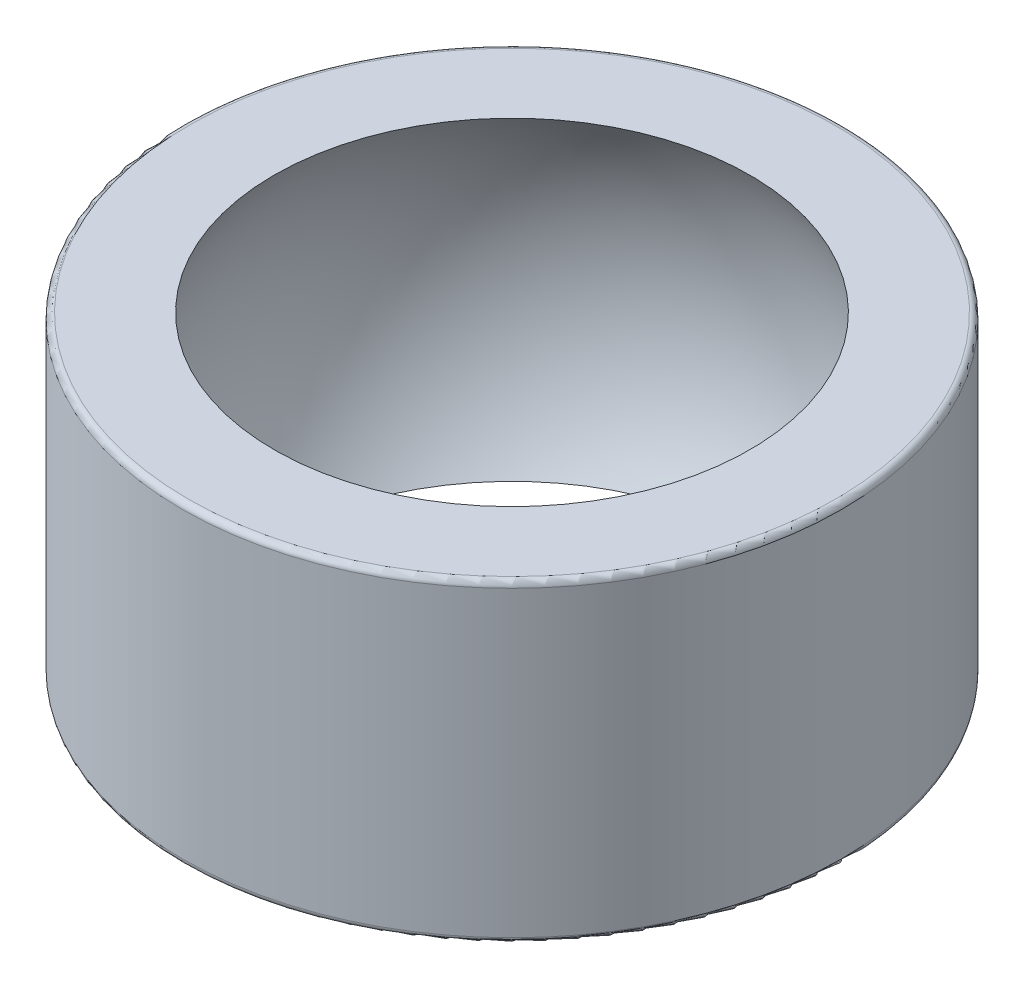
from build123d import *

# Parameters (mm, degrees)
SZKIC1_R                    = 11
DODANIE_WYCI_GNI_CIE1_DEPTH = 5.25
ZAOKR_GLENIE1_R             = 0.2


with BuildPart() as part:
    # Szkic1 → Dodanie-wyciągnięcie1 (new, symmetric)
    with BuildSketch(Plane(origin=(0, 0, 0), x_dir=(1, 0, 0), z_dir=(0, 1, 0))):
        with Locations(Location((0, 0, 0), (0, 0, 90))):
            Circle(SZKIC1_R)
    extrude(amount=DODANIE_WYCI_GNI_CIE1_DEPTH, both=True)

    # Szkic3 → Wycięcie-obrót1 (revolve, cut)
    with BuildSketch(Plane.XY):
        with BuildLine():
            Line((0, -9.52), (0, 9.52))
            ThreePointArc((0, 9.52), (9.52, 0), (0, -9.52))
        make_face()
    revolve(axis=Axis((0, -9.52, 0), (0, 1, 0)), mode=Mode.SUBTRACT)

    # Zaokrąglenie1
    zaokr_glenie1_edges = [part.edges().sort_by_distance(p)[0] for p in [
        (0, -5.25, 11),
        (0, 5.25, 11),
    ]]
    fillet(zaokr_glenie1_edges, radius=ZAOKR_GLENIE1_R)


solid = part.part
